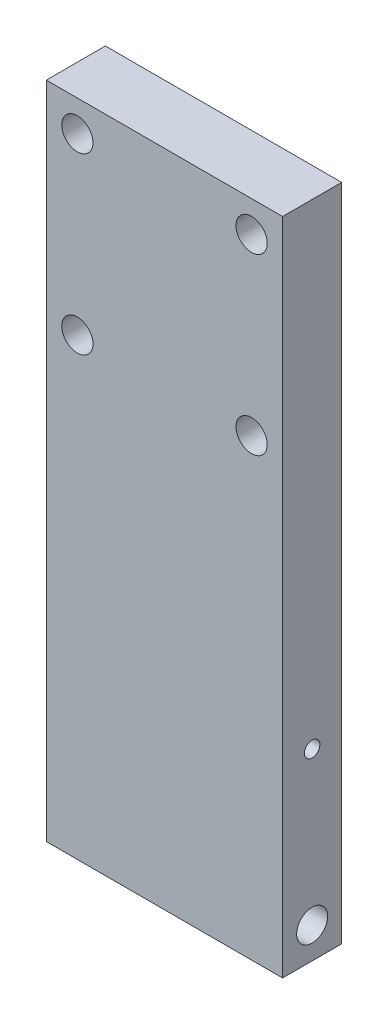
from build123d import *

# Parameters (mm, degrees)
CROQUIS1_W                      = 76.2
CROQUIS1_H                      = 212.7
SALIENTE_EXTRUIR1_DEPTH         = 9.525
DI_METRO_DE_TALADRO_10_0_10_1_D = 10
TALADRO_ROSCADO_M61_D           = 5
TALADRO_ROSCADO_M61_DEPTH       = 10
TALADRO_ROSCADO_M61_TIP         = 1.502151548
TALADRO_DE_MARGEN_PARA_3_81_D   = 10.0838


with BuildPart() as part:
    # Croquis1 → Saliente-Extruir1 (new, symmetric)
    with BuildSketch(Plane.XY):
        Rectangle(CROQUIS1_W, CROQUIS1_H)
    extrude(amount=SALIENTE_EXTRUIR1_DEPTH, both=True)

    # Diámetro de taladro Ø10.0 (10)1 (through all)
    with Locations(Plane(origin=(38.1, 0, 0), x_dir=(0, 0, -1), z_dir=(1, 0, 0))):
        with Locations((0, -96.35)):
            Hole(DI_METRO_DE_TALADRO_10_0_10_1_D / 2)

    # Taladro roscado M61
    with Locations(Plane(origin=(38.1, 0, 0), x_dir=(0, 0, -1), z_dir=(1, 0, 0))):
        with Locations((0, -47.15)):
            Hole(TALADRO_ROSCADO_M61_D / 2, depth=TALADRO_ROSCADO_M61_DEPTH)
            with Locations((0, 0, -(TALADRO_ROSCADO_M61_DEPTH + TALADRO_ROSCADO_M61_TIP / 2))):  # 118° drill point
                Cone(0, TALADRO_ROSCADO_M61_D / 2, TALADRO_ROSCADO_M61_TIP, mode=Mode.SUBTRACT)

    # Taladro de margen para 3/81 (through all)
    with Locations(Plane(origin=(0, 0, -9.525), x_dir=(-1, 0, 0), z_dir=(0, 0, -1))):
        with Locations((-28.1, 96.35), (-28.1, 40.15), (28.1, 40.15), (28.1, 96.35)):
            Hole(TALADRO_DE_MARGEN_PARA_3_81_D / 2)


solid = part.part
